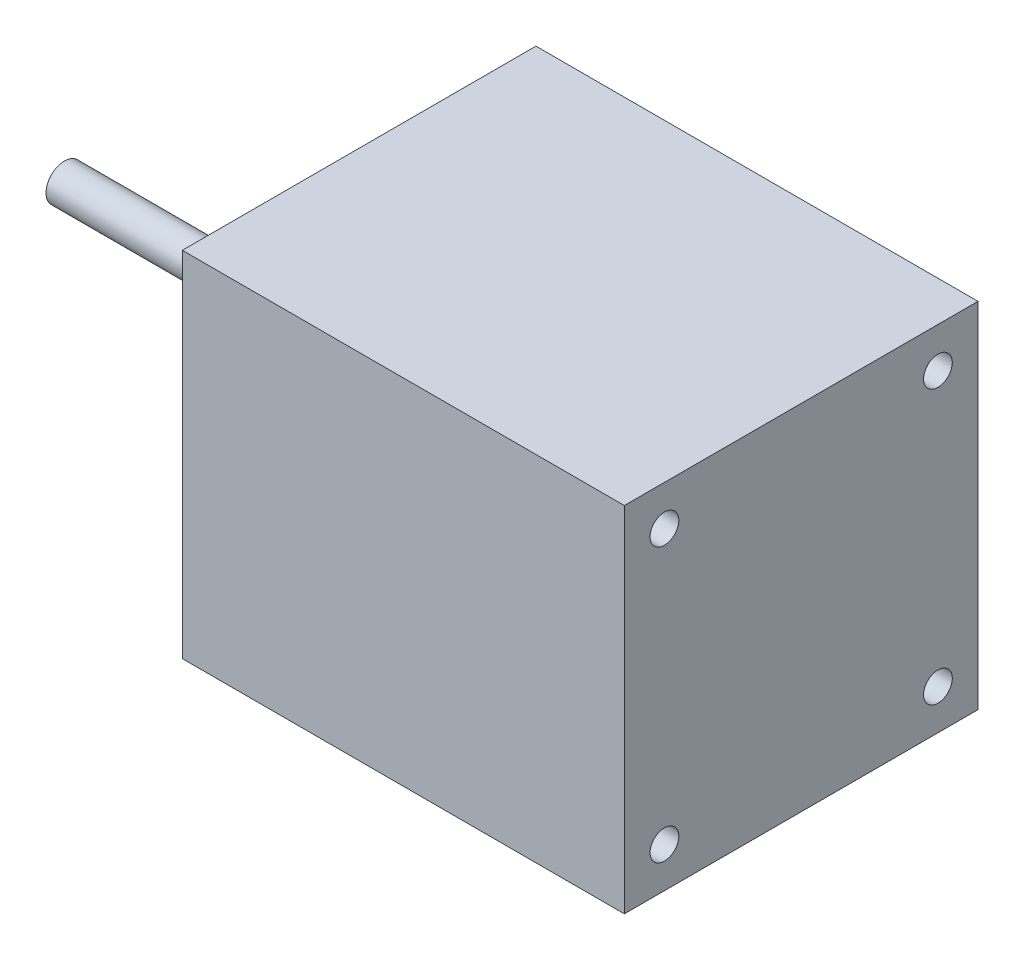
from build123d import *

# Parameters (mm, degrees)
SKETCH1_W           = 60.96
SKETCH1_H           = 60.96
SKETCH1_R           = 2.4765
BOSS_EXTRUDE3_DEPTH = 76.2
SKETCH3_R           = 3.175
BOSS_EXTRUDE4_DEPTH = 50.8


with BuildPart() as part:
    # Sketch1 → Boss-Extrude3 (new body)
    with BuildSketch(Plane(origin=(0, 0, 0), x_dir=(0, 0, -1), z_dir=(1, 0, 0))):
        Rectangle(SKETCH1_W, SKETCH1_H)
        with Locations(Location((-23.573172318, 23.573172318, 0), (0, 0, 180))):
            Circle(SKETCH1_R, mode=Mode.SUBTRACT)
        with Locations(Location((23.573172318, 23.573172318, 0), (0, 0, 180))):
            Circle(SKETCH1_R, mode=Mode.SUBTRACT)
        with Locations(Location((23.573172318, -23.573172318, 0), (0, 0, 180))):
            Circle(SKETCH1_R, mode=Mode.SUBTRACT)
        with Locations(Location((-23.573172318, -23.573172318, 0), (0, 0, 180))):
            Circle(SKETCH1_R, mode=Mode.SUBTRACT)
    extrude(amount=BOSS_EXTRUDE3_DEPTH)

    # Sketch3 → Boss-Extrude4 (add)
    with BuildSketch(Plane.ZY):
        with Locations(Location((0, 0, 0), (0, 0, 180))):
            Circle(SKETCH3_R)
    extrude(amount=BOSS_EXTRUDE4_DEPTH)


solid = part.part
